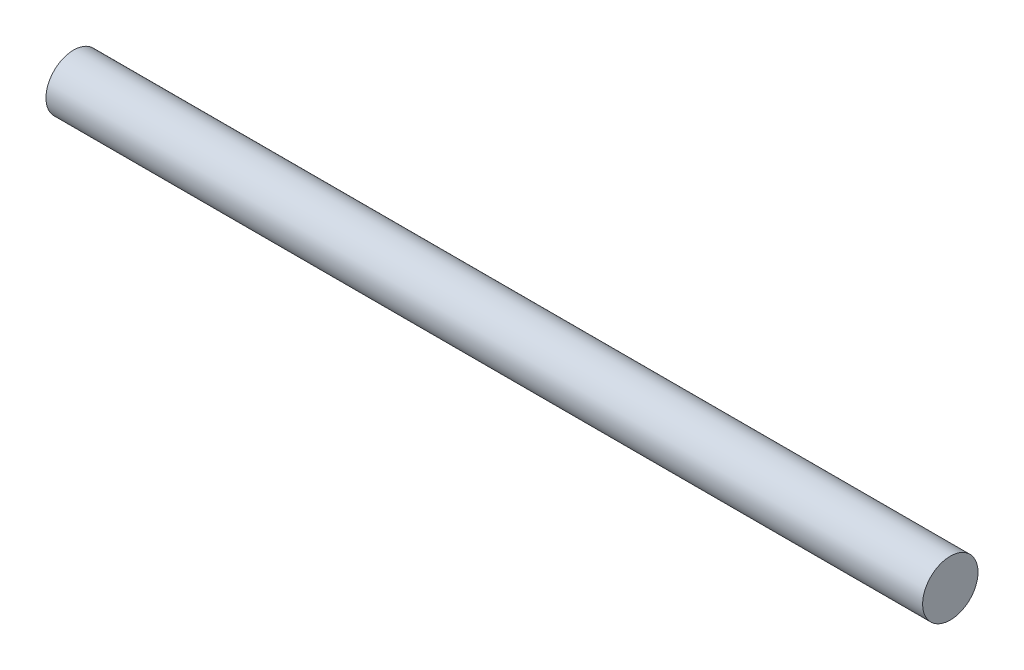
from build123d import *

# Parameters (mm, degrees)
SKETCH1_R           = 2.4
BOSS_EXTRUDE1_DEPTH = 38


with BuildPart() as part:
    # Sketch1 → Boss-Extrude1 (new, symmetric)
    with BuildSketch(Plane(origin=(0, 0, 0), x_dir=(0, 0, -1), z_dir=(1, 0, 0))):
        Circle(SKETCH1_R)
    extrude(amount=BOSS_EXTRUDE1_DEPTH, both=True)


solid = part.part
